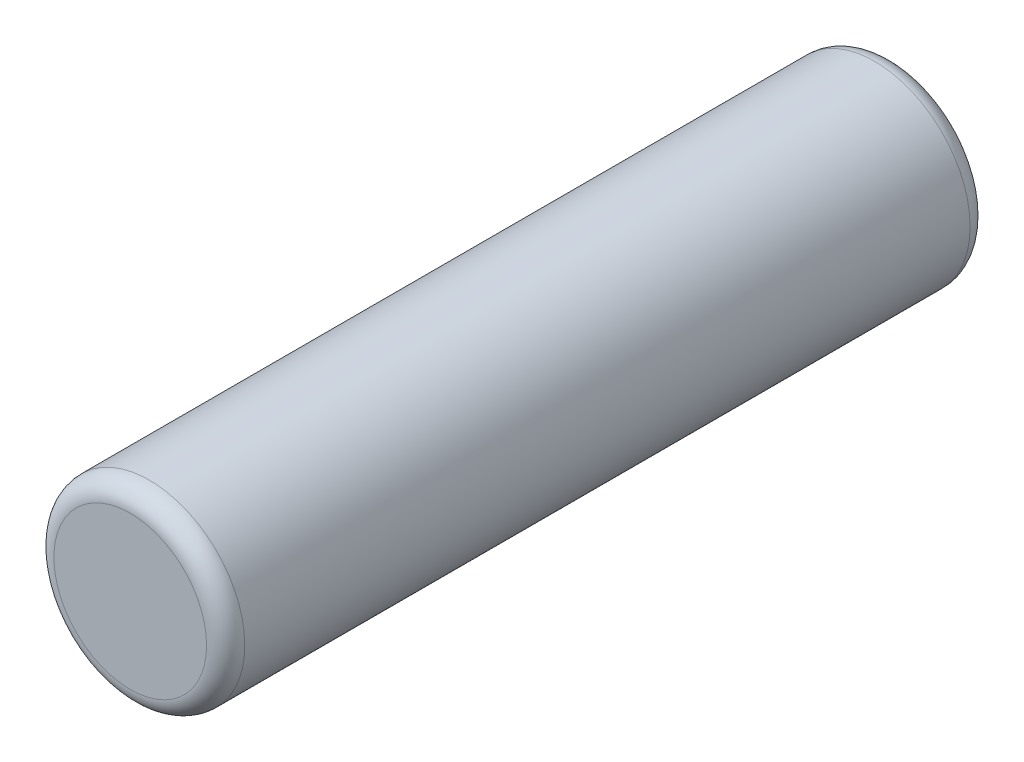
from build123d import *

# Parameters (mm, degrees)
SKETCH1_R           = 2.5
BOSS_EXTRUDE1_DEPTH = 20
FILLET1_R           = 0.5


with BuildPart() as part:
    # Sketch1 → Boss-Extrude1 (new body)
    with BuildSketch(Plane.XY):
        Circle(SKETCH1_R)
    extrude(amount=BOSS_EXTRUDE1_DEPTH)

    # Fillet1
    fillet1_edges = [part.edges().sort_by_distance(p)[0] for p in [
        (-2.5, 0, 0),
        (-2.5, 0, 20),
    ]]
    fillet(fillet1_edges, radius=FILLET1_R)


solid = part.part
